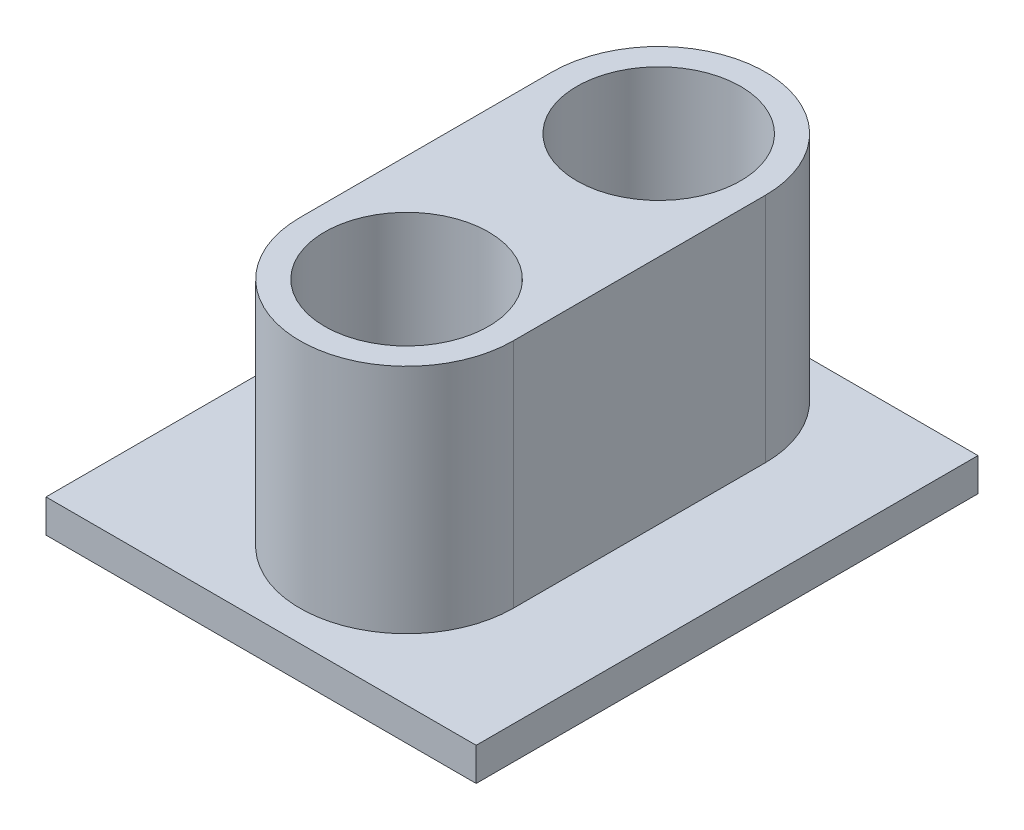
from build123d import *

# Parameters (mm, degrees)
SKETCH_1_W          = 26
SKETCH_1_H          = 30.33
EXTRUDE_1_DEPTH     = 2
SKETCH_2_R          = 4.95
CUT_EXTRUDE_1_DEPTH = 21.07429264
EXTRUDE_START       = 14
SKETCH_3_R          = 4.95
EXTRUDE_2_DEPTH     = 14


with BuildPart() as part:
    # Эскиз1 → Бобышка-Вытянуть1 (new body)
    with BuildSketch(Plane(origin=(0, 0, 0), x_dir=(1, 0, 0), z_dir=(0, 1, 0))):
        Rectangle(SKETCH_1_W, SKETCH_1_H)
    extrude(amount=EXTRUDE_1_DEPTH)

    # Эскиз2 → Вырез-Вытянуть1 (cut, through all)
    with BuildSketch(Plane(origin=(0, 2, 0), x_dir=(1, 0, 0), z_dir=(0, 1, 0))):
        with Locations(Location((0.5, -6.870000865, 0), (0, 0, 270))):
            Circle(SKETCH_2_R)
        with Locations(Location((0.5, 8.367040316, 0), (0, 0, 270))):
            Circle(SKETCH_2_R)
    extrude(amount=-CUT_EXTRUDE_1_DEPTH, mode=Mode.SUBTRACT)

    # Эскиз3 → Бобышка-Вытянуть2 (add)
    with BuildSketch(Plane(origin=(0, 2, 0), x_dir=(1, 0, 0), z_dir=(0, 1, 0)).offset(EXTRUDE_START)):
        with BuildLine():
            Line((-5.95, -6.870000865), (-5.95, 8.367040316))
            ThreePointArc((-5.95, 8.367040316), (0.5, 14.817040316), (6.95, 8.367040316))
            Line((6.95, 8.367040316), (6.95, -6.870000865))
            ThreePointArc((6.95, -6.870000865), (0.5, -13.320000865), (-5.95, -6.870000865))
        make_face()
        with Locations(Location((0.5, -6.870000865, 0), (0, 0, 270))):
            Circle(SKETCH_3_R, mode=Mode.SUBTRACT)
        with Locations(Location((0.5, 8.367040316, 0), (0, 0, 270))):
            Circle(SKETCH_3_R, mode=Mode.SUBTRACT)
    extrude(amount=-EXTRUDE_2_DEPTH)


solid = part.part
